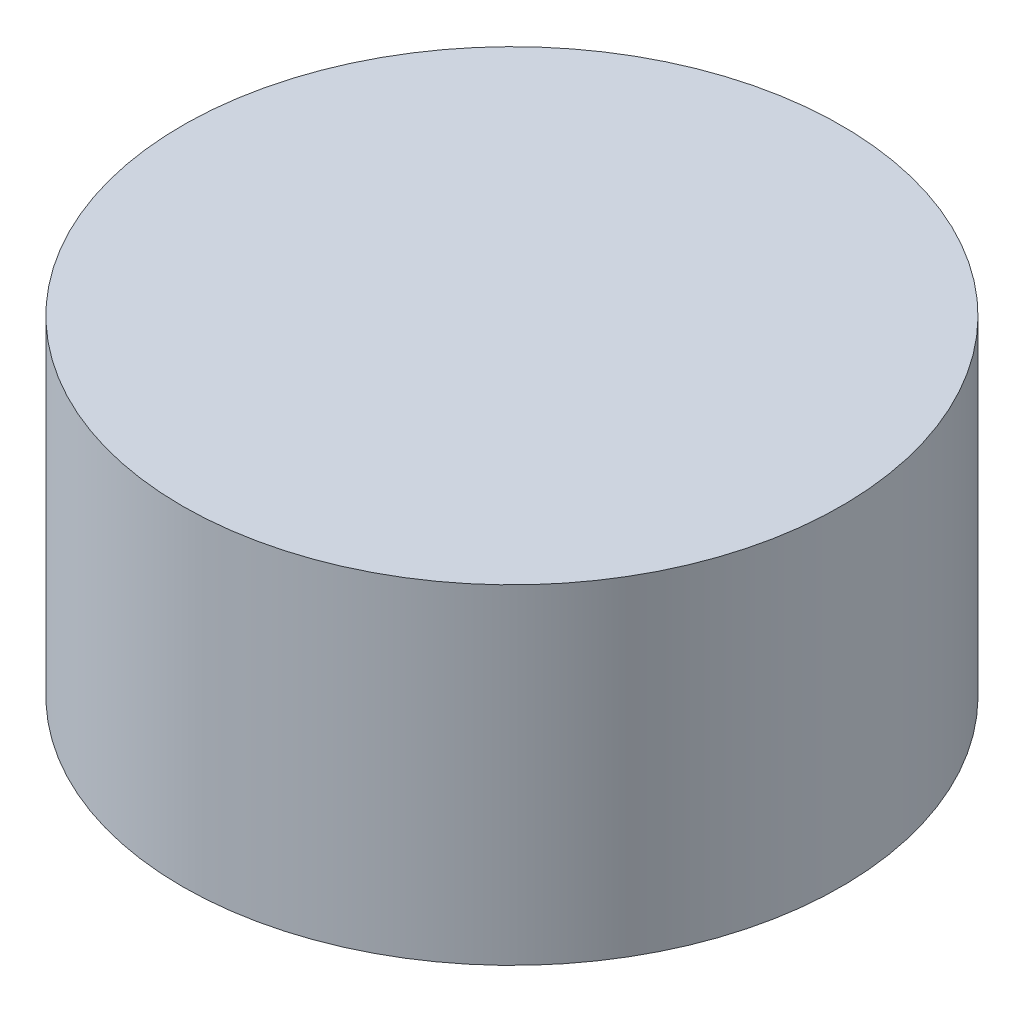
from build123d import *

# Parameters (mm, degrees)
SKETCH1_R           = 3.175
BOSS_EXTRUDE1_DEPTH = 3.175


with BuildPart() as part:
    # Sketch1 → Boss-Extrude1 (new body)
    with BuildSketch(Plane(origin=(0, 0, 0), x_dir=(1, 0, 0), z_dir=(0, 1, 0))):
        with Locations(Location((0, 0, 0), (0, 0, 270))):
            Circle(SKETCH1_R)
    extrude(amount=BOSS_EXTRUDE1_DEPTH)


solid = part.part
